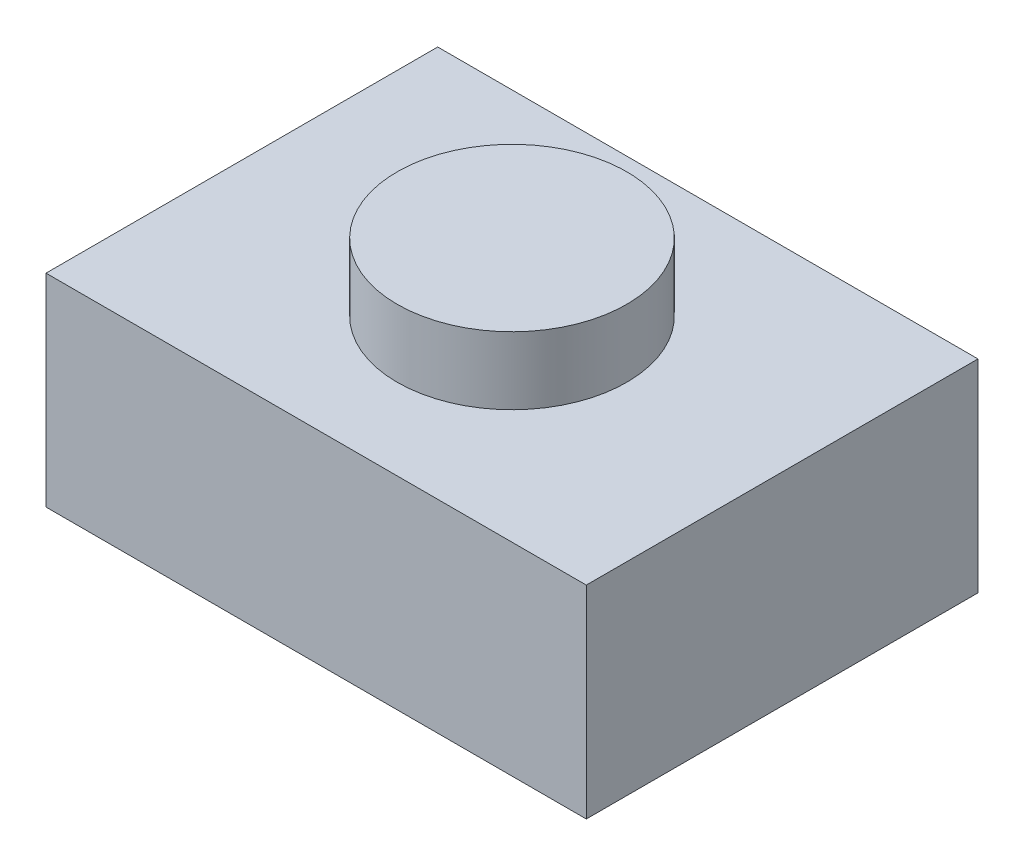
from build123d import *

# Parameters (mm, degrees)
CROQUIS1_W              = 4
CROQUIS1_H              = 2.9
SALIENTE_EXTRUIR1_DEPTH = 1.5
CROQUIS2_R              = 0.85
SALIENTE_EXTRUIR2_DEPTH = 0.5


with BuildPart() as part:
    # Croquis1 → Saliente-Extruir1 (new body)
    with BuildSketch(Plane(origin=(0, 0, 0), x_dir=(1, 0, 0), z_dir=(0, 1, 0))):
        Rectangle(CROQUIS1_W, CROQUIS1_H)
    extrude(amount=SALIENTE_EXTRUIR1_DEPTH)

    # Croquis2 → Saliente-Extruir2 (add)
    with BuildSketch(Plane(origin=(0, 1.5, 0), x_dir=(1, 0, 0), z_dir=(0, 1, 0))):
        with Locations(Location((0, 0, 0), (0, 0, 270))):
            Circle(CROQUIS2_R)
    extrude(amount=SALIENTE_EXTRUIR2_DEPTH)


solid = part.part
